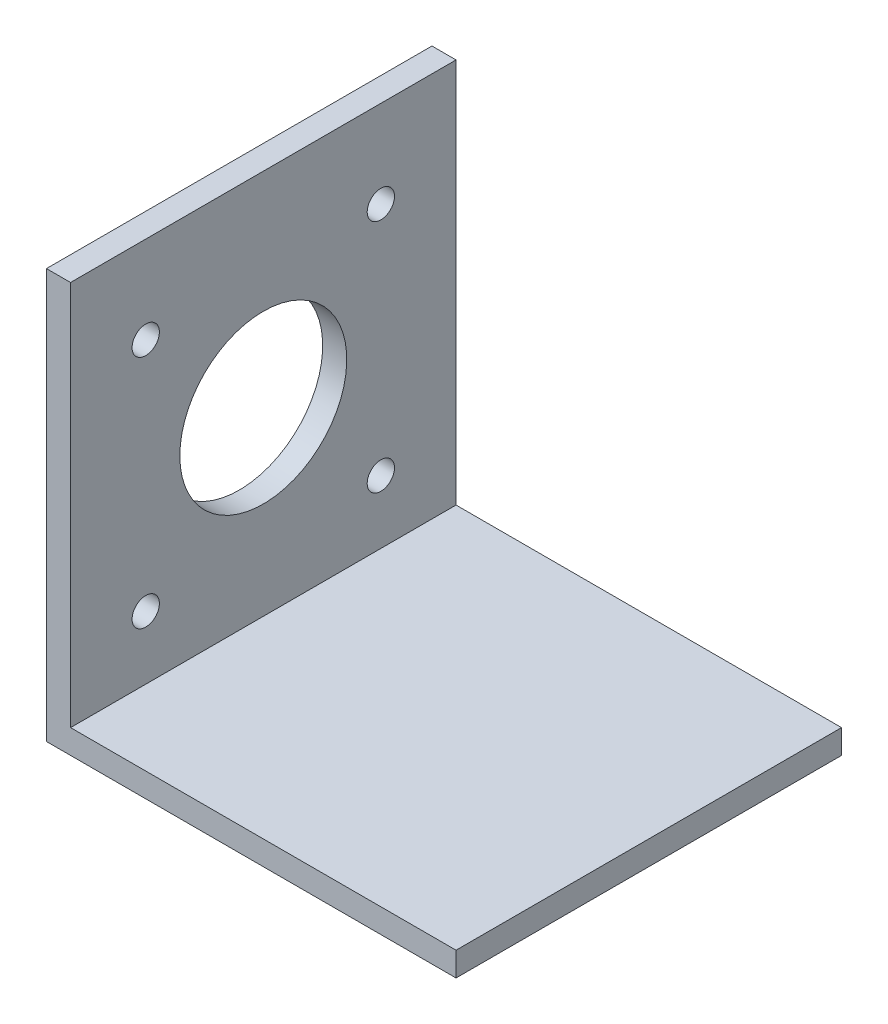
from build123d import *

# Parameters (mm, degrees)
EXTRUDE_THIN1_DEPTH  = 50.8
SKETCH2_R            = 11
CUT_EXTRUDE1_DEPTH   = 90.858670283
M3_CLEARANCE_HOLE1_D = 3.6


with BuildPart() as part:
    # Sketch1 → Extrude-Thin1 (new body)
    with BuildSketch(Plane.XY):
        Polygon((0, 50.8), (0, 0), (50.8, 0), (50.8, -3.175), (-3.175, -3.175), (-3.175, 50.8), align=None)
    extrude(amount=EXTRUDE_THIN1_DEPTH)

    # Sketch2 → Cut-Extrude1 (cut, through all)
    with BuildSketch(Plane.ZY.offset(3.175)):
        with Locations((25.4, 23.8125)):
            Circle(SKETCH2_R)
    extrude(amount=-CUT_EXTRUDE1_DEPTH, mode=Mode.SUBTRACT)

    # M3 Clearance Hole1 (through all)
    with Locations(Plane.ZY.offset(3.175)):
        with Locations((9.909058191, 39.303441809), (40.890941809, 39.303441809), (40.890941809, 8.321558191), (9.909058191, 8.321558191)):
            Hole(M3_CLEARANCE_HOLE1_D / 2)


solid = part.part
